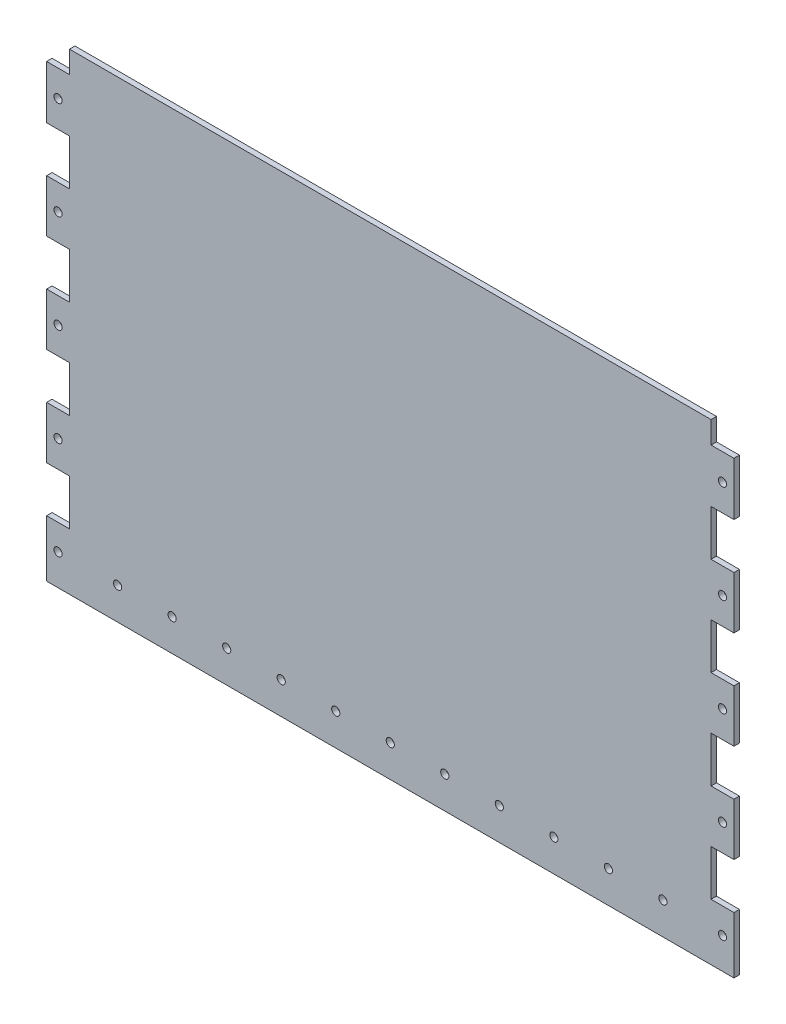
from build123d import *

# Parameters (mm, degrees)
SKETCH_1_W          = 252.1
SKETCH_1_H          = 166.2
EXTRUDE_1_DEPTH     = 1
SKETCH_2_R          = 1.5
SKETCH_2_W          = 8.4
SKETCH_2_H          = 16.8
SKETCH_2_W_2        = 252.1
SKETCH_2_H_2        = 0.2
SKETCH_2_H_3        = 1
CUT_EXTRUDE1_DEPTH  = 10
SKETCH1_R           = 1.5
CUT_EXTRUDE2_DEPTH  = 10
SKETCH2_W           = 235.3
SKETCH2_H           = 8.1
BOSS_EXTRUDE1_DEPTH = 2


with BuildPart() as part:
    # 草图1 → 凸台-拉伸1 (new, symmetric)
    with BuildSketch(Plane.XY):
        Rectangle(SKETCH_1_W, SKETCH_1_H)
    extrude(amount=EXTRUDE_1_DEPTH, both=True)

    # 草图2 → Cut-Extrude1 (cut)
    with BuildSketch(Plane.XY.offset(1)):
        with Locations((-121.85, 73.3)):
            Circle(SKETCH_2_R)
        with Locations((-121.85, 37.3)):
            Circle(SKETCH_2_R)
        with Locations((-121.85, 1.3)):
            Circle(SKETCH_2_R)
        with Locations((-121.85, -34.7)):
            Circle(SKETCH_2_R)
        with Locations((-121.85, -70.7)):
            Circle(SKETCH_2_R)
        with Locations((121.85, -70.7)):
            Circle(SKETCH_2_R)
        with Locations((121.85, -34.7)):
            Circle(SKETCH_2_R)
        with Locations((121.85, 1.3)):
            Circle(SKETCH_2_R)
        with Locations((121.85, 37.3)):
            Circle(SKETCH_2_R)
        with Locations((121.85, 73.3)):
            Circle(SKETCH_2_R)
        with Locations((-121.85, 55.1)):
            Rectangle(SKETCH_2_W, SKETCH_2_H)
        with Locations((-121.85, 19.1)):
            Rectangle(SKETCH_2_W, SKETCH_2_H)
        with Locations((-121.85, -16.9)):
            Rectangle(SKETCH_2_W, SKETCH_2_H)
        with Locations((-121.85, -52.9)):
            Rectangle(SKETCH_2_W, SKETCH_2_H)
        with Locations((121.85, -52.9)):
            Rectangle(SKETCH_2_W, SKETCH_2_H)
        with Locations((121.85, -16.9)):
            Rectangle(SKETCH_2_W, SKETCH_2_H)
        with Locations((121.85, 19.1)):
            Rectangle(SKETCH_2_W, SKETCH_2_H)
        with Locations((121.85, 55.1)):
            Rectangle(SKETCH_2_W, SKETCH_2_H)
        with Locations((0, 83.089141708)):
            Rectangle(SKETCH_2_W_2, SKETCH_2_H_2)
        with Locations((0, -82.6)):
            Rectangle(SKETCH_2_W_2, SKETCH_2_H_3)
    extrude(amount=-CUT_EXTRUDE1_DEPTH, mode=Mode.SUBTRACT)

    # Sketch1 → Cut-Extrude2 (cut)
    with BuildSketch(Plane.XY.offset(1)):
        with Locations((100, -70.35)):
            Circle(SKETCH1_R)
        with Locations((80, -70.35)):
            Circle(SKETCH1_R)
        with Locations((60, -70.35)):
            Circle(SKETCH1_R)
        with Locations((40, -70.35)):
            Circle(SKETCH1_R)
        with Locations((20, -70.35)):
            Circle(SKETCH1_R)
        with Locations((0, -70.35)):
            Circle(SKETCH1_R)
        with Locations((-20, -70.35)):
            Circle(SKETCH1_R)
        with Locations((-40, -70.35)):
            Circle(SKETCH1_R)
        with Locations((-60, -70.35)):
            Circle(SKETCH1_R)
        with Locations((-80, -70.35)):
            Circle(SKETCH1_R)
        with Locations((-100, -70.35)):
            Circle(SKETCH1_R)
    extrude(amount=-CUT_EXTRUDE2_DEPTH, mode=Mode.SUBTRACT)

    # Sketch2 → Boss-Extrude1 (add)
    with BuildSketch(Plane.XY.offset(1)):
        with Locations((0, 87.039141708)):
            Rectangle(SKETCH2_W, SKETCH2_H)
    extrude(amount=-BOSS_EXTRUDE1_DEPTH)


solid = part.part
